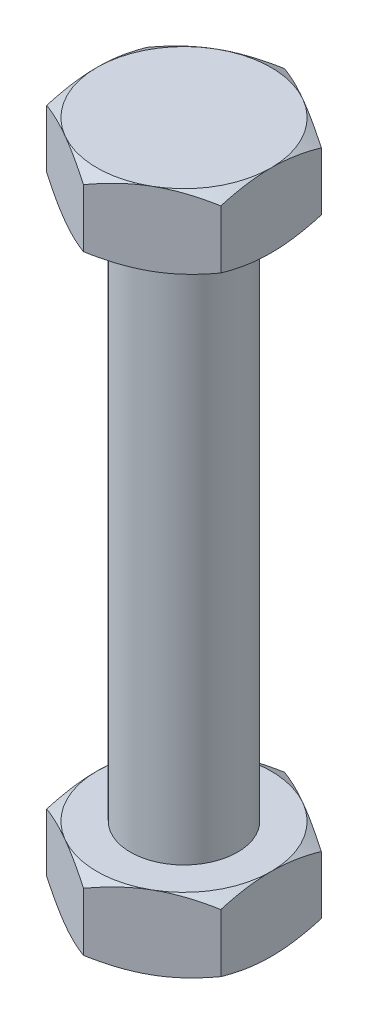
from build123d import *

# Parameters (mm, degrees)
SKETCH_2_R          = 12.5
CUT_EXTRUDE_1_DEPTH = 53.92447449


with BuildPart() as part:
    # 草图1 → 旋转1 (revolve)
    with BuildSketch(Plane.XY, mode=Mode.PRIVATE) as revolve_1_sk:
        Polygon((0, 25.5), (10, 25.5), (10, 20), (4, 20), (4, -20), (10, -20), (10, -25.5), (0, -25.5), align=None)
    revolve(revolve_1_sk.sketch.rotate(Axis((0, 0, 0), (0, 1, 0)), 90), axis=Axis((0, 0, 0), (0, 1, 0)))

    # 草图2 → 切除-拉伸1 (cut, through all)
    with BuildSketch(Plane(origin=(0, 25.5, 0), x_dir=(1, 0, 0), z_dir=(0, 1, 0))):
        Circle(SKETCH_2_R)
        Polygon((0, 7.505553499), (-6.5, 3.75277675), (-6.5, -3.75277675), (0, -7.505553499), (6.5, -3.75277675), (6.5, 3.75277675), align=None, mode=Mode.SUBTRACT)
    extrude(amount=-CUT_EXTRUDE_1_DEPTH, mode=Mode.SUBTRACT)

    # 草图3 → 切除-旋转1 (revolve, cut)
    with BuildSketch(Plane.XY):
        Polygon((6.5, 25.5), (9, 25.5), (9, 24.056624327), align=None)
        Polygon((9, 21.443375673), (9, 20), (6.5, 20), align=None)
        Polygon((6.5, -20), (9, -20), (9, -21.443375673), align=None)
        Polygon((6.5, -25.5), (9, -25.5), (9, -24.056624327), align=None)
    revolve(axis=Axis((0, 0, 0), (0, 1, 0)), mode=Mode.SUBTRACT)


solid = part.part
